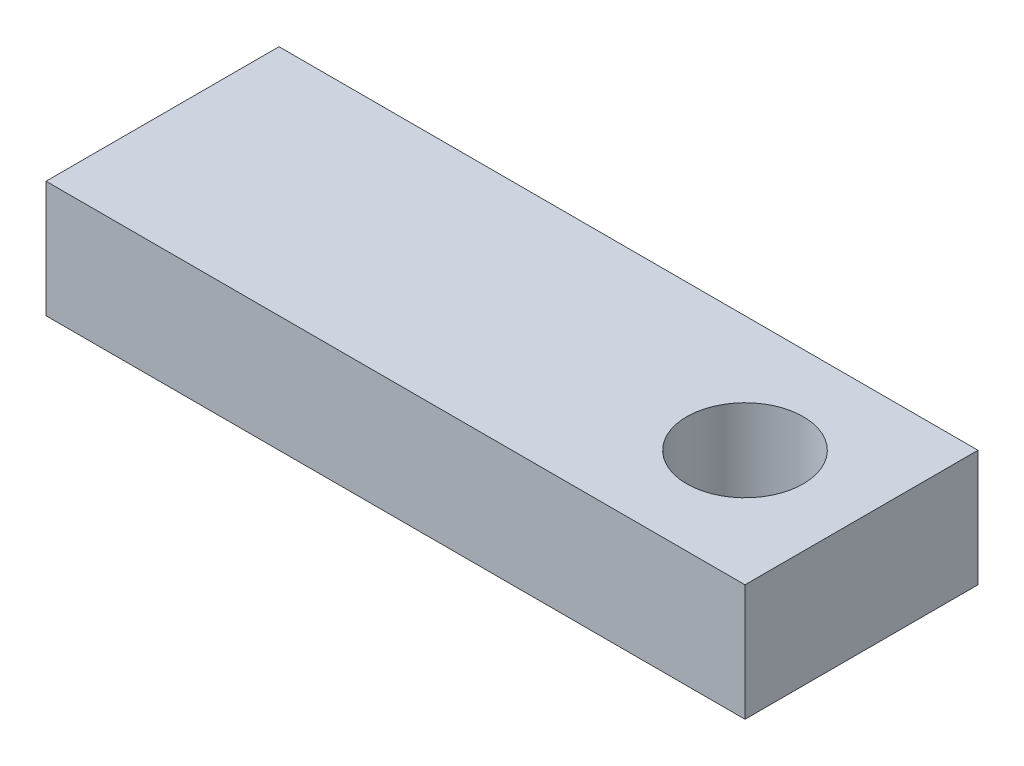
from build123d import *

# Parameters (mm, degrees)
SKETCH1_W           = 76.2
SKETCH1_H           = 25.4
SKETCH1_R           = 6.35
BOSS_EXTRUDE1_DEPTH = 12.7


with BuildPart() as part:
    # Sketch1 → Boss-Extrude1 (new body)
    with BuildSketch(Plane(origin=(0, 0, 0), x_dir=(1, 0, 0), z_dir=(0, 1, 0))):
        Rectangle(SKETCH1_W, SKETCH1_H)
        with Locations(Location((25.4, 0, 0), (0, 0, 270))):
            Circle(SKETCH1_R, mode=Mode.SUBTRACT)
    extrude(amount=BOSS_EXTRUDE1_DEPTH)


solid = part.part
